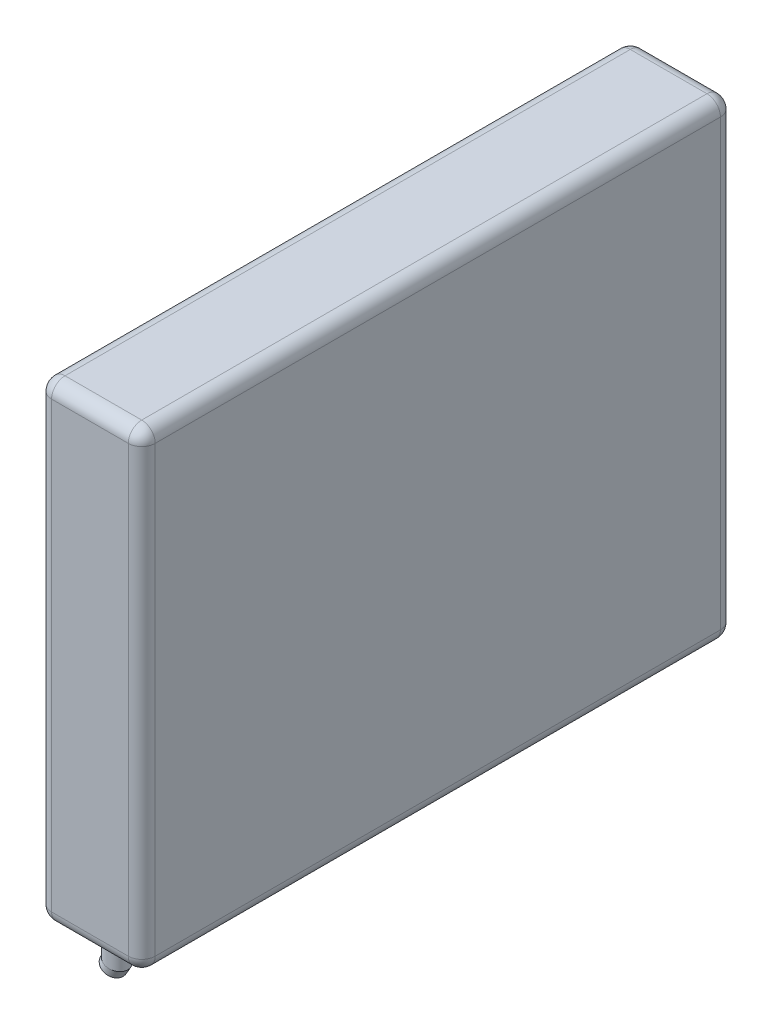
from build123d import *

# Parameters (mm, degrees)
SKETCH1_W           = 22
SKETCH1_H           = 17.5
BOSS_EXTRUDE1_DEPTH = 1.925
SKETCH2_R           = 0.4064
FILLET1_R           = 0.5


with BuildPart() as part:
    # Sketch1 → Boss-Extrude1 (new, symmetric)
    with BuildSketch(Plane(origin=(0, 0, 0), x_dir=(0, 0, -1), z_dir=(1, 0, 0))):
        Rectangle(SKETCH1_W, SKETCH1_H)
    extrude(amount=BOSS_EXTRUDE1_DEPTH, both=True)

    # Sweep1: sweep along a path in Sketch3
    with BuildLine(Plane.XY.offset(10)) as sweep1_path:
        Line((0, -8.75), (0, -9.588170614))
        Line((0, -9.588170614), (-0.118311478, -9.793092105))
    # Sketch2 → Sweep1 (sweep)
    with BuildSketch(Plane.XZ.offset(8.75)):
        with Locations((0, 10)):
            Circle(SKETCH2_R)
    sweep1 = sweep(path=sweep1_path.line, transition=Transition.RIGHT)

    # Fillet1
    fillet1_edges = [part.edges().sort_by_distance(p)[0] for p in [
        (1.925, 0, 11),
        (1.925, -8.75, 0),
        (1.925, 0, -11),
        (-1.925, -8.75, 0),
        (-1.925, 0, 11),
        (-1.925, 8.75, 0),
        (-1.925, 0, -11),
        (0, -8.75, -11),
        (0, -8.75, 11),
        (0, 8.75, 11),
        (0, 8.75, -11),
        (1.925, 8.75, 0),
    ]]
    fillet(fillet1_edges, radius=FILLET1_R)

    # Mirror1: Sweep1 across plane
    add(sweep1.mirror(Plane.XY))


solid = part.part
